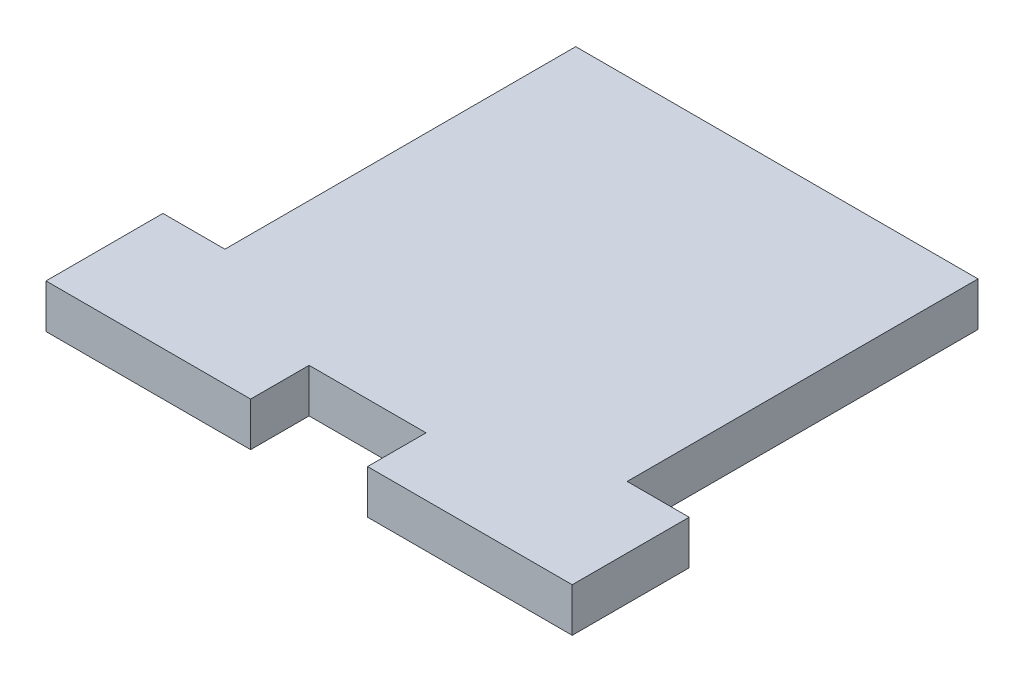
from build123d import *

# Parameters (mm, degrees)
BOSS_EXTRUDE1_DEPTH = 7.5


with BuildPart() as part:
    # Sketch1 → Boss-Extrude1 (new body)
    with BuildSketch(Plane(origin=(0, 0, 0), x_dir=(1, 0, 0), z_dir=(0, 1, 0))):
        Polygon((0, 0), (-68.8, 0), (-68.8, -60), (-79.4, -60), (-79.4, -80), (-44.4, -80), (-44.4, -70), (-24.4, -70), (-24.4, -80), (10.6, -80), (10.6, -60), (0, -60), align=None)
    extrude(amount=-BOSS_EXTRUDE1_DEPTH)


solid = part.part
